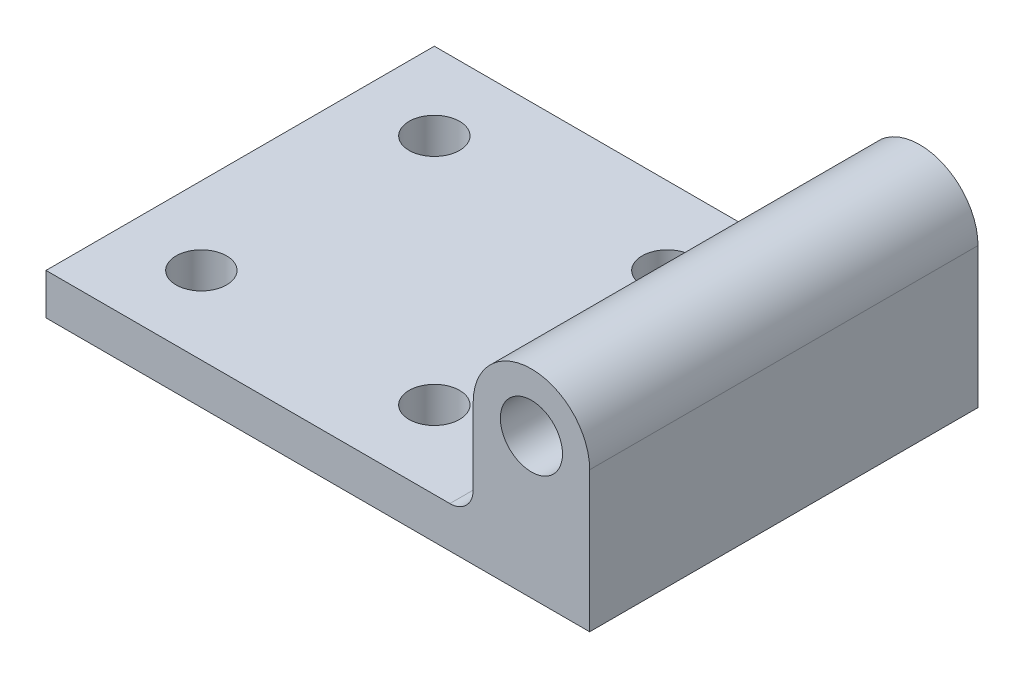
from build123d import *

# Parameters (mm, degrees)
SKETCH1_W           = 50
SKETCH1_H           = 50
SKETCH1_R           = 3.25
SKETCH1_W_2         = 20
BOSS_EXTRUDE1_DEPTH = 5.3
SKETCH2_R           = 4
BOSS_EXTRUDE2_DEPTH = 50
FILLET1_R           = 3


with BuildPart() as part:
    # Sketch1 → Boss-Extrude1 (new body)
    # profile 1 of 2: a face of its own
    with BuildSketch(Plane(origin=(0, 0, 0), x_dir=(1, 0, 0), z_dir=(0, 1, 0))):
        with Locations((25, -25)):
            Rectangle(SKETCH1_W, SKETCH1_H)
        with Locations(Location((10, -40, 0), (0, 0, 270))):
            Circle(SKETCH1_R, mode=Mode.SUBTRACT)
        with Locations(Location((40, -40, 0), (0, 0, 270))):
            Circle(SKETCH1_R, mode=Mode.SUBTRACT)
        with Locations(Location((40, -10, 0), (0, 0, 270))):
            Circle(SKETCH1_R, mode=Mode.SUBTRACT)
        with Locations(Location((10, -10, 0), (0, 0, 270))):
            Circle(SKETCH1_R, mode=Mode.SUBTRACT)
    # profile 2 of 2: a face of its own
    with BuildSketch(Plane(origin=(0, 0, 0), x_dir=(1, 0, 0), z_dir=(0, 1, 0))):
        with Locations((60, -25)):
            Rectangle(SKETCH1_W_2, SKETCH1_H)
    extrude(amount=BOSS_EXTRUDE1_DEPTH)

    # Sketch2 → Boss-Extrude2 (add)
    with BuildSketch(Plane.XY.offset(50)):
        with BuildLine():
            Line((55, 18.071423244), (55, 5.3))
            Line((55, 5.3), (70, 5.3))
            Line((70, 5.3), (70, 18.071423244))
            ThreePointArc((70, 18.071423244), (62.5, 25.571423244), (55, 18.071423244))
        make_face()
        with Locations((62.5, 18.071423244)):
            Circle(SKETCH2_R, mode=Mode.SUBTRACT)
    extrude(amount=-BOSS_EXTRUDE2_DEPTH)

    # Fillet1
    fillet1_edges = [part.edges().sort_by_distance(p)[0] for p in [
        (55, 5.3, 25),
    ]]
    fillet(fillet1_edges, radius=FILLET1_R)


solid = part.part
